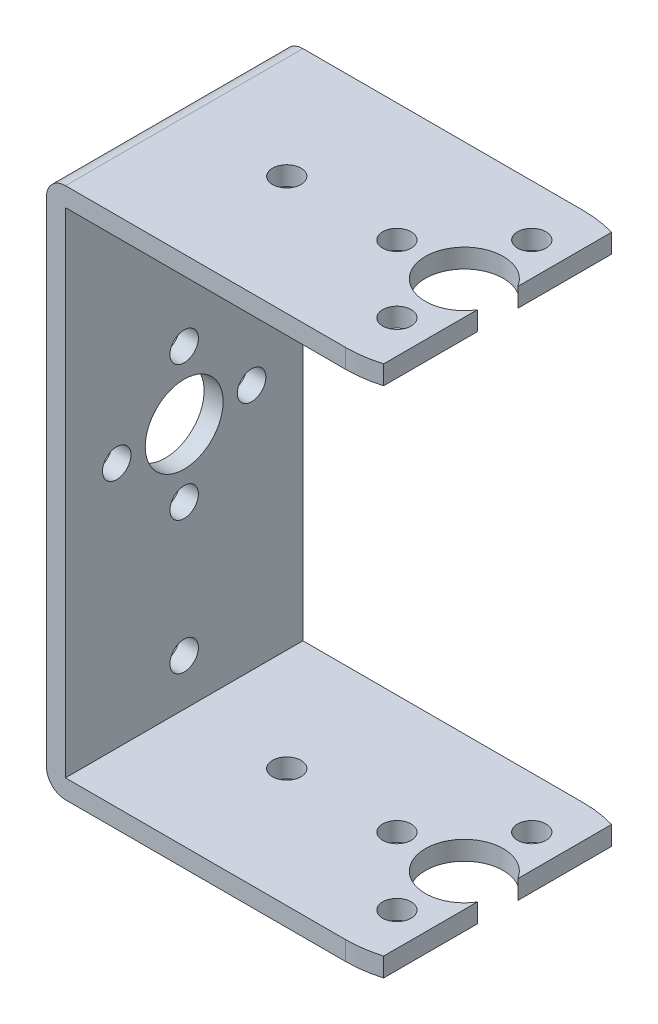
from build123d import *

# Parameters (mm, degrees)
SKETCH_1_W          = 44
SKETCH_1_H          = 25
EXTRUDE_1_DEPTH     = 2
SKETCH_2_W          = 2
SKETCH_2_H          = 25
EXTRUDE_2_DEPTH     = 56
FILLET_1_RADIUS     = 12.5
FILLET_1_LENGTH     = 2
CUT_EXTRUDE_2_REACH = 63.451
SKETCH_3_R          = 4.1
SKETCH_3_R_2        = 1.5
CUT_EXTRUDE_3_REACH = 74.307
SKETCH_4_R          = 4.1
SKETCH_4_R_2        = 1.5
FILLET_2_R          = 2
SKETCH_5_W          = 11
SKETCH_5_H          = 30
CUT_EXTRUDE_4_DEPTH = 62.451200151


with BuildPart() as part:
    # 草图1 → 凸台-拉伸1 (new body)
    with BuildSketch(Plane(origin=(0, 0, 0), x_dir=(1, 0, 0), z_dir=(0, 1, 0))):
        Rectangle(SKETCH_1_W, SKETCH_1_H)
    extrude(amount=-EXTRUDE_1_DEPTH)

    # 草图2 → 凸台-拉伸2 (add)
    with BuildSketch(Plane(origin=(0, 0, 0), x_dir=(1, 0, 0), z_dir=(0, 1, 0))):
        with Locations((-21, 0)):
            Rectangle(SKETCH_2_W, SKETCH_2_H)
    extrude(amount=-EXTRUDE_2_DEPTH)

    # 圆角1: full round fillet: the end face becomes a half cylinder, R = half its width
    fillet_1_face = Plane((22, -1, 0), x_dir=(0, 1, 0), z_dir=(1, 0, 0))  # on the end face: x along it, z out of the body
    fillet_1_slab = fillet_1_face.offset(-FILLET_1_RADIUS / 2) * Box(FILLET_1_LENGTH, 2 * FILLET_1_RADIUS, FILLET_1_RADIUS, mode=Mode.PRIVATE)  # the body's end, R deep
    fillet_1_round = Plane((9.5, -1, 0), x_dir=(1, 0, 0), z_dir=(0, 1, 0)) * Cylinder(FILLET_1_RADIUS, FILLET_1_LENGTH, mode=Mode.PRIVATE)  # its axis R under the face
    add(fillet_1_slab - fillet_1_round, mode=Mode.SUBTRACT)

    # 草图3 → 切除-拉伸2 (cut, up to next)
    with BuildSketch(Plane(origin=(0, 0, 0), x_dir=(1, 0, 0), z_dir=(0, 1, 0)), mode=Mode.PRIVATE) as cut_extrude_2_sk1:
        with Locations(Location((9.5, 0, 0), (0, 0, 270))):
            Circle(SKETCH_3_R)
    cut_extrude_2_tool1 = extrude(cut_extrude_2_sk1.sketch, amount=-CUT_EXTRUDE_2_REACH, mode=Mode.PRIVATE) & part.part
    # 草图3 → 切除-拉伸2 (cut, up to next)
    with BuildSketch(Plane(origin=(0, 0, 0), x_dir=(1, 0, 0), z_dir=(0, 1, 0)), mode=Mode.PRIVATE) as cut_extrude_2_sk2:
        with Locations(Location((2.4, 0, 0), (0, 0, 270))):
            Circle(SKETCH_3_R_2)
    cut_extrude_2_tool2 = extrude(cut_extrude_2_sk2.sketch, amount=-CUT_EXTRUDE_2_REACH, mode=Mode.PRIVATE) & part.part
    # 草图3 → 切除-拉伸2 (cut, up to next)
    with BuildSketch(Plane(origin=(0, 0, 0), x_dir=(1, 0, 0), z_dir=(0, 1, 0)), mode=Mode.PRIVATE) as cut_extrude_2_sk3:
        with Locations(Location((9.5, 7.1, 0), (0, 0, 270))):
            Circle(SKETCH_3_R_2)
    cut_extrude_2_tool3 = extrude(cut_extrude_2_sk3.sketch, amount=-CUT_EXTRUDE_2_REACH, mode=Mode.PRIVATE) & part.part
    # 草图3 → 切除-拉伸2 (cut, up to next)
    with BuildSketch(Plane(origin=(0, 0, 0), x_dir=(1, 0, 0), z_dir=(0, 1, 0)), mode=Mode.PRIVATE) as cut_extrude_2_sk4:
        with Locations(Location((16.6, 0, 0), (0, 0, 270))):
            Circle(SKETCH_3_R_2)
    cut_extrude_2_tool4 = extrude(cut_extrude_2_sk4.sketch, amount=-CUT_EXTRUDE_2_REACH, mode=Mode.PRIVATE) & part.part
    # 草图3 → 切除-拉伸2 (cut, up to next)
    with BuildSketch(Plane(origin=(0, 0, 0), x_dir=(1, 0, 0), z_dir=(0, 1, 0)), mode=Mode.PRIVATE) as cut_extrude_2_sk5:
        with Locations(Location((9.5, -7.1, 0), (0, 0, 270))):
            Circle(SKETCH_3_R_2)
    cut_extrude_2_tool5 = extrude(cut_extrude_2_sk5.sketch, amount=-CUT_EXTRUDE_2_REACH, mode=Mode.PRIVATE) & part.part
    # 草图3 → 切除-拉伸2 (cut, up to next)
    with BuildSketch(Plane(origin=(0, 0, 0), x_dir=(1, 0, 0), z_dir=(0, 1, 0)), mode=Mode.PRIVATE) as cut_extrude_2_sk6:
        with Locations(Location((-9.2, 0, 0), (0, 0, 270))):
            Circle(SKETCH_3_R_2)
    cut_extrude_2_tool6 = extrude(cut_extrude_2_sk6.sketch, amount=-CUT_EXTRUDE_2_REACH, mode=Mode.PRIVATE) & part.part
    add(cut_extrude_2_tool1.solids().sort_by_distance((9.5, 0, 0))[0], mode=Mode.SUBTRACT)
    add(cut_extrude_2_tool2.solids().sort_by_distance((2.4, 0, 0))[0], mode=Mode.SUBTRACT)
    add(cut_extrude_2_tool3.solids().sort_by_distance((9.5, 0, -7.1))[0], mode=Mode.SUBTRACT)
    add(cut_extrude_2_tool4.solids().sort_by_distance((16.6, 0, 0))[0], mode=Mode.SUBTRACT)
    add(cut_extrude_2_tool5.solids().sort_by_distance((9.5, 0, 7.1))[0], mode=Mode.SUBTRACT)
    add(cut_extrude_2_tool6.solids().sort_by_distance((-9.2, 0, 0))[0], mode=Mode.SUBTRACT)

    # 镜向2: part across plane


with BuildPart() as part_1:
    add(part.part)
    add(part.part.mirror(Plane.ZX.offset(-28)))

    # 草图4 → 切除-拉伸3 (cut, up to next)
    with BuildSketch(Plane.ZY.offset(22), mode=Mode.PRIVATE) as cut_extrude_3_sk1:
        with Locations((0, -28)):
            Circle(SKETCH_4_R)
    cut_extrude_3_tool1 = extrude(cut_extrude_3_sk1.sketch, amount=-CUT_EXTRUDE_3_REACH, mode=Mode.PRIVATE) & part_1.part
    # 草图4 → 切除-拉伸3 (cut, up to next)
    with BuildSketch(Plane.ZY.offset(22), mode=Mode.PRIVATE) as cut_extrude_3_sk2:
        with Locations((0, -20.9)):
            Circle(SKETCH_4_R_2)
    cut_extrude_3_tool2 = extrude(cut_extrude_3_sk2.sketch, amount=-CUT_EXTRUDE_3_REACH, mode=Mode.PRIVATE) & part_1.part
    # 草图4 → 切除-拉伸3 (cut, up to next)
    with BuildSketch(Plane.ZY.offset(22), mode=Mode.PRIVATE) as cut_extrude_3_sk3:
        with Locations((7.1, -28)):
            Circle(SKETCH_4_R_2)
    cut_extrude_3_tool3 = extrude(cut_extrude_3_sk3.sketch, amount=-CUT_EXTRUDE_3_REACH, mode=Mode.PRIVATE) & part_1.part
    # 草图4 → 切除-拉伸3 (cut, up to next)
    with BuildSketch(Plane.ZY.offset(22), mode=Mode.PRIVATE) as cut_extrude_3_sk4:
        with Locations((0, -35.1)):
            Circle(SKETCH_4_R_2)
    cut_extrude_3_tool4 = extrude(cut_extrude_3_sk4.sketch, amount=-CUT_EXTRUDE_3_REACH, mode=Mode.PRIVATE) & part_1.part
    # 草图4 → 切除-拉伸3 (cut, up to next)
    with BuildSketch(Plane.ZY.offset(22), mode=Mode.PRIVATE) as cut_extrude_3_sk5:
        with Locations((-7.1, -28)):
            Circle(SKETCH_4_R_2)
    cut_extrude_3_tool5 = extrude(cut_extrude_3_sk5.sketch, amount=-CUT_EXTRUDE_3_REACH, mode=Mode.PRIVATE) & part_1.part
    # 草图4 → 切除-拉伸3 (cut, up to next)
    with BuildSketch(Plane.ZY.offset(22), mode=Mode.PRIVATE) as cut_extrude_3_sk6:
        with Locations((0, -6.9)):
            Circle(SKETCH_4_R_2)
    cut_extrude_3_tool6 = extrude(cut_extrude_3_sk6.sketch, amount=-CUT_EXTRUDE_3_REACH, mode=Mode.PRIVATE) & part_1.part
    # 草图4 → 切除-拉伸3 (cut, up to next)
    with BuildSketch(Plane.ZY.offset(22), mode=Mode.PRIVATE) as cut_extrude_3_sk7:
        with Locations(Location((0, -49.1, 0), (0, 0, 180))):
            Circle(SKETCH_4_R_2)
    cut_extrude_3_tool7 = extrude(cut_extrude_3_sk7.sketch, amount=-CUT_EXTRUDE_3_REACH, mode=Mode.PRIVATE) & part_1.part
    add(cut_extrude_3_tool1.solids().sort_by_distance((-22, -28, 0))[0], mode=Mode.SUBTRACT)
    add(cut_extrude_3_tool2.solids().sort_by_distance((-22, -20.9, 0))[0], mode=Mode.SUBTRACT)
    add(cut_extrude_3_tool3.solids().sort_by_distance((-22, -28, 7.1))[0], mode=Mode.SUBTRACT)
    add(cut_extrude_3_tool4.solids().sort_by_distance((-22, -35.1, 0))[0], mode=Mode.SUBTRACT)
    add(cut_extrude_3_tool5.solids().sort_by_distance((-22, -28, -7.1))[0], mode=Mode.SUBTRACT)
    add(cut_extrude_3_tool6.solids().sort_by_distance((-22, -6.9, 0))[0], mode=Mode.SUBTRACT)
    add(cut_extrude_3_tool7.solids().sort_by_distance((-22, -49.1, 0))[0], mode=Mode.SUBTRACT)

    # 圆角2
    fillet_2_edges = [part_1.edges().sort_by_distance(p)[0] for p in [
        (-22, -56, 0),
        (-22, 0, 0),
    ]]
    fillet(fillet_2_edges, radius=FILLET_2_R)

    # 草图5 → 切除-拉伸4 (cut, through all)
    with BuildSketch(Plane(origin=(0, 0, 0), x_dir=(1, 0, 0), z_dir=(0, 1, 0))):
        with Locations((18.5, 0)):
            Rectangle(SKETCH_5_W, SKETCH_5_H)
    extrude(amount=-CUT_EXTRUDE_4_DEPTH, mode=Mode.SUBTRACT)


solid = part_1.part
